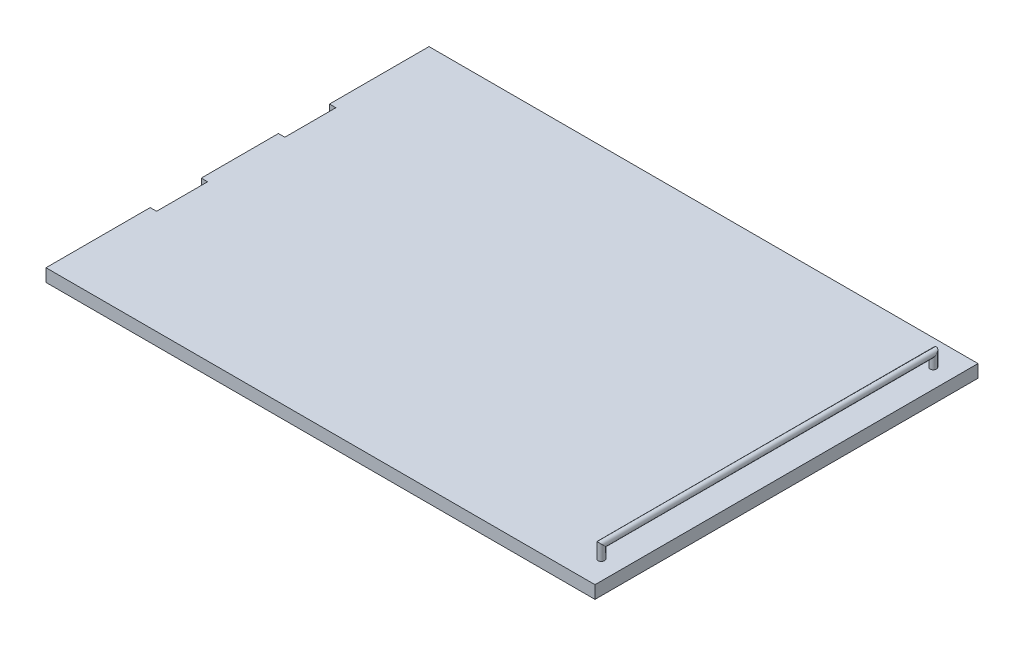
from build123d import *

# Parameters (mm, degrees)
SKETCH1_W           = 1092.2
SKETCH1_H           = 762
BOSS_EXTRUDE1_DEPTH = 25.4
CUT_EXTRUDE1_DEPTH  = 667.356788815
SWEEP1_PROFILE_R    = 6.35


with BuildPart() as part:
    # Sketch1 → Boss-Extrude1 (new body)
    with BuildSketch(Plane(origin=(0, 0, 0), x_dir=(1, 0, 0), z_dir=(0, 1, 0))):
        Rectangle(SKETCH1_W, SKETCH1_H)
    extrude(amount=BOSS_EXTRUDE1_DEPTH)

    # Sketch2 → Cut-Extrude1 (cut, through all)
    with BuildSketch(Plane(origin=(0, 25.4, 0), x_dir=(1, 0, 0), z_dir=(0, 1, 0))):
        Polygon((-546.1, 183.043938976), (-546.1, 132.243938976), (-546.1, 81.443938976), (-533.4, 81.443938976), (-533.4, 183.043938976), align=None)
        Polygon((-546.1, -122.927339743), (-546.1, -173.727339743), (-533.4, -173.727339743), (-533.4, -72.127339743), (-546.1, -72.127339743), align=None)
    extrude(amount=-CUT_EXTRUDE1_DEPTH, mode=Mode.SUBTRACT)

    # Sweep1: sweep along a path in Sketch3
    with BuildLine(Plane(origin=(508, 0, 0), x_dir=(0, 0, -1), z_dir=(1, 0, 0))) as sweep1_path:
        Line((-330.2, 25.4), (-330.2, 50.8))
        Line((-330.2, 50.8), (330.2, 50.8))
        Line((330.2, 50.8), (330.2, 25.4))
    # Sweep1 profile (on start of the path) → Sweep1 (sweep)
    with BuildSketch(Plane(origin=(508, 25.4, 330.2), x_dir=(0, 0, 1), z_dir=(0, 1, 0))):
        Circle(SWEEP1_PROFILE_R)
    sweep(path=sweep1_path.line, transition=Transition.RIGHT)


solid = part.part
